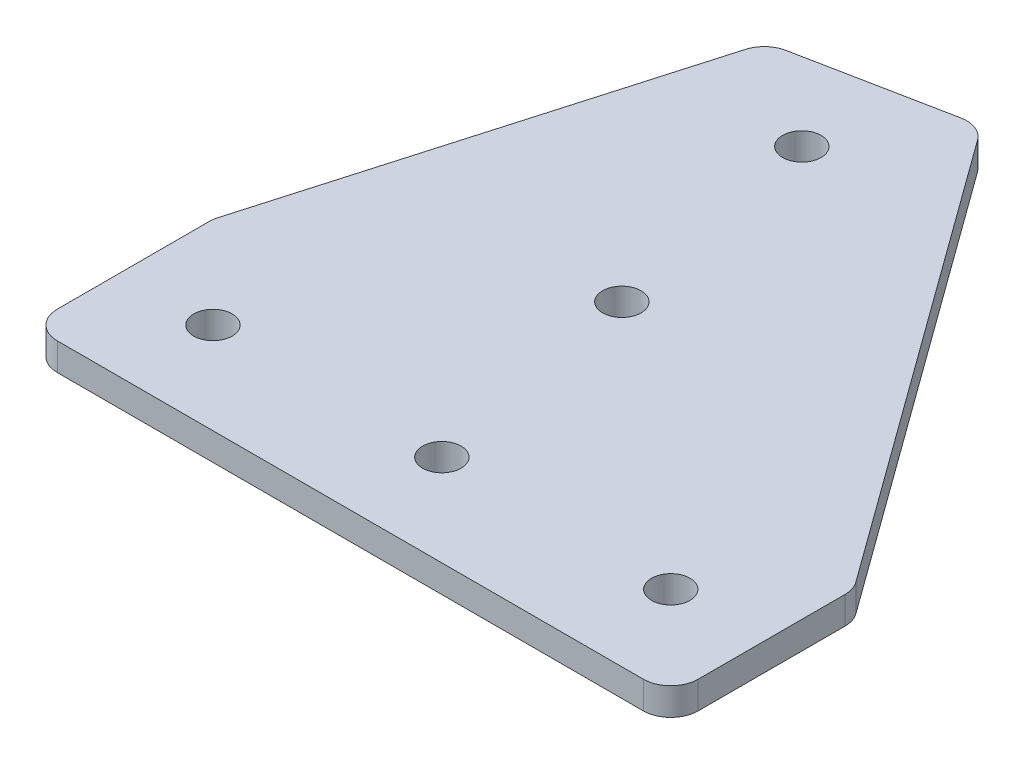
from build123d import *

# Parameters (mm, degrees)
SKETCH_1_W      = 70
SKETCH_1_H      = 20
SKETCH_1_R      = 2.1
EXTRUDE_1_DEPTH = 3
FILLET_1_R      = 3


with BuildPart() as part:
    # 草图1 → 凸台-拉伸1 (new body)
    # profile 1 of 4: a face of its own
    with BuildSketch(Plane(origin=(0, 0, 0), x_dir=(1, 0, 0), z_dir=(0, 1, 0))):
        Polygon((-1.865732489, 60.799005274), (8.211170098, 10), (35, 10), align=None)
    # profile 2 of 4: a face of its own
    with BuildSketch(Plane(origin=(0, 0, 0), x_dir=(1, 0, 0), z_dir=(0, 1, 0))):
        Rectangle(SKETCH_1_W, SKETCH_1_H)
        with Locations(Location((-25, 0, 0), (0, 0, 270))):
            Circle(SKETCH_1_R, mode=Mode.SUBTRACT)
        with Locations(Location((25, 0, 0), (0, 0, 270))):
            Circle(SKETCH_1_R, mode=Mode.SUBTRACT)
        with Locations(Location((0, 0, 0), (0, 0, 270))):
            Circle(SKETCH_1_R, mode=Mode.SUBTRACT)
    # profile 3 of 4: a face of its own
    with BuildSketch(Plane(origin=(0, 0, 0), x_dir=(1, 0, 0), z_dir=(0, 1, 0))):
        Polygon((-35, 10), (-12.178532268, 10), (-21.48347839, 56.907470127), align=None)
    # profile 4 of 4: a face of its own
    with BuildSketch(Plane(origin=(0, 0, 0), x_dir=(1, 0, 0), z_dir=(0, 1, 0))):
        Polygon((-12.178532268, 10), (8.211170098, 10), (-1.865732489, 60.799005274), (-21.48347839, 56.907470127), align=None)
        with Locations(Location((-4.864418933, 24.522182375, 0), (0, 0, 270))):
            Circle(SKETCH_1_R, mode=Mode.SUBTRACT)
        with Locations(Location((-9.728837866, 49.04436475, 0), (0, 0, 270))):
            Circle(SKETCH_1_R, mode=Mode.SUBTRACT)
    extrude(amount=EXTRUDE_1_DEPTH)

    # 圆角1
    fillet_1_edges = [part.edges().sort_by_distance(p)[0] for p in [
        (-1.865732489, 1.5, -60.799005274),
        (35, 1.5, -10),
        (35, 1.5, 10),
        (-35, 1.5, 10),
        (-35, 1.5, -10),
        (-21.48347839, 1.5, -56.907470127),
    ]]
    fillet(fillet_1_edges, radius=FILLET_1_R)


solid = part.part
